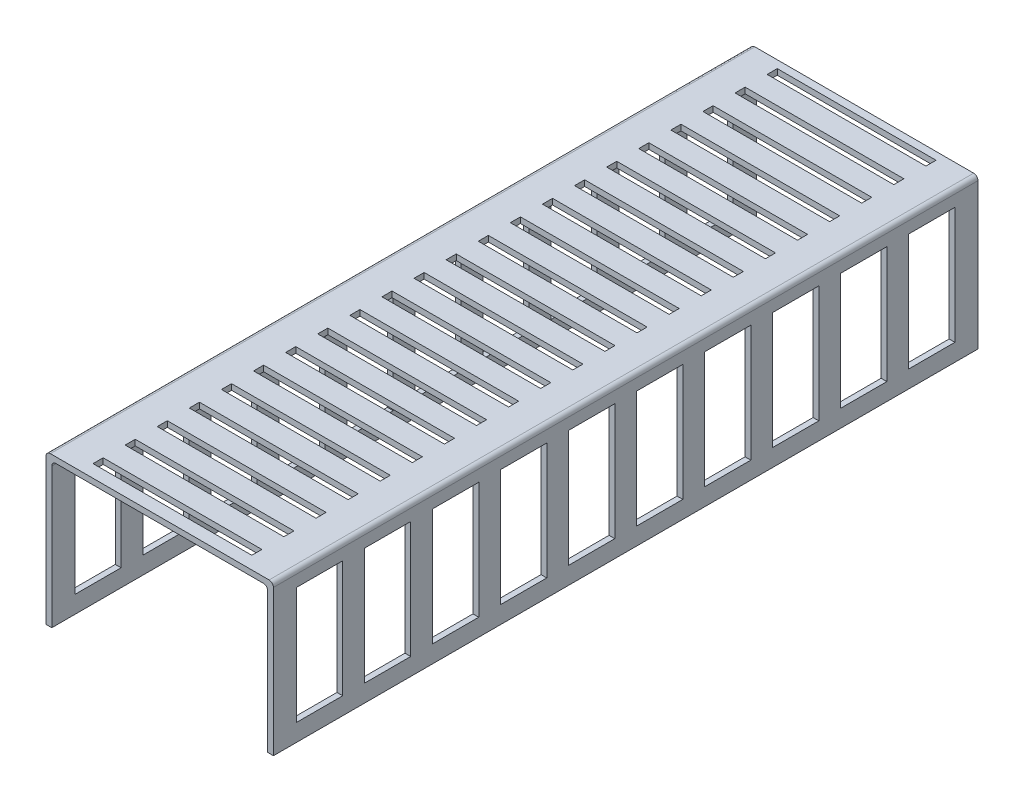
from build123d import *

# Parameters (mm, degrees)
SKETCH2_W           = 78.8
SKETCH2_H           = 244.1
SKETCH2_W_2         = 55
SKETCH2_H_2         = 3.5
BOSS_EXTRUDE1_DEPTH = 2
SKETCH3_W           = 2
SKETCH3_H           = 244.1
BOSS_EXTRUDE2_DEPTH = 50
FILLET1_R           = 1.5
SKETCH4_W           = 16
SKETCH4_H           = 40.5
CUT_EXTRUDE1_DEPTH  = 27275.317552699


with BuildPart() as part:
    # Sketch2 → Boss-Extrude1 (new body)
    with BuildSketch(Plane(origin=(0, 27271.849263039, 0), x_dir=(1, 0, 0), z_dir=(0, 1, 0))):
        with Locations((-7.2, 17)):
            Rectangle(SKETCH2_W, SKETCH2_H)
        with Locations((-7.2, 123.528571429)):
            Rectangle(SKETCH2_W_2, SKETCH2_H_2, mode=Mode.SUBTRACT)
        with Locations((-7.2, 134.65)):
            Rectangle(SKETCH2_W_2, SKETCH2_H_2, mode=Mode.SUBTRACT)
        with Locations((-7.2, 112.407142857)):
            Rectangle(SKETCH2_W_2, SKETCH2_H_2, mode=Mode.SUBTRACT)
        with Locations((-7.2, 101.285714286)):
            Rectangle(SKETCH2_W_2, SKETCH2_H_2, mode=Mode.SUBTRACT)
        with Locations((-7.2, 90.164285714)):
            Rectangle(SKETCH2_W_2, SKETCH2_H_2, mode=Mode.SUBTRACT)
        with Locations((-7.2, 79.042857143)):
            Rectangle(SKETCH2_W_2, SKETCH2_H_2, mode=Mode.SUBTRACT)
        with Locations((-7.2, 67.921428571)):
            Rectangle(SKETCH2_W_2, SKETCH2_H_2, mode=Mode.SUBTRACT)
        with Locations((-7.2, 56.8)):
            Rectangle(SKETCH2_W_2, SKETCH2_H_2, mode=Mode.SUBTRACT)
        with Locations((-7.2, 45.678571429)):
            Rectangle(SKETCH2_W_2, SKETCH2_H_2, mode=Mode.SUBTRACT)
        with Locations((-7.2, 34.557142857)):
            Rectangle(SKETCH2_W_2, SKETCH2_H_2, mode=Mode.SUBTRACT)
        with Locations((-7.2, 23.435714286)):
            Rectangle(SKETCH2_W_2, SKETCH2_H_2, mode=Mode.SUBTRACT)
        with Locations((-7.2, 12.314285714)):
            Rectangle(SKETCH2_W_2, SKETCH2_H_2, mode=Mode.SUBTRACT)
        with Locations((-7.2, 1.192857143)):
            Rectangle(SKETCH2_W_2, SKETCH2_H_2, mode=Mode.SUBTRACT)
        with Locations((-7.2, -9.928571429)):
            Rectangle(SKETCH2_W_2, SKETCH2_H_2, mode=Mode.SUBTRACT)
        with Locations((-7.2, -21.05)):
            Rectangle(SKETCH2_W_2, SKETCH2_H_2, mode=Mode.SUBTRACT)
        with Locations((-7.2, -32.171428571)):
            Rectangle(SKETCH2_W_2, SKETCH2_H_2, mode=Mode.SUBTRACT)
        with Locations((-7.2, -43.292857143)):
            Rectangle(SKETCH2_W_2, SKETCH2_H_2, mode=Mode.SUBTRACT)
        with Locations((-7.2, -54.414285714)):
            Rectangle(SKETCH2_W_2, SKETCH2_H_2, mode=Mode.SUBTRACT)
        with Locations((-7.2, -65.535714286)):
            Rectangle(SKETCH2_W_2, SKETCH2_H_2, mode=Mode.SUBTRACT)
        with Locations((-7.2, -76.657142857)):
            Rectangle(SKETCH2_W_2, SKETCH2_H_2, mode=Mode.SUBTRACT)
        with Locations((-7.2, -87.778571429)):
            Rectangle(SKETCH2_W_2, SKETCH2_H_2, mode=Mode.SUBTRACT)
        with Locations((-7.2, -98.9)):
            Rectangle(SKETCH2_W_2, SKETCH2_H_2, mode=Mode.SUBTRACT)
    extrude(amount=BOSS_EXTRUDE1_DEPTH)

    # Sketch3 → Boss-Extrude2 (add)
    with BuildSketch(Plane.XZ.offset(-27271.849263039)):
        with Locations((-45.6, -17)):
            Rectangle(SKETCH3_W, SKETCH3_H)
        with Locations((31.2, -17)):
            Rectangle(SKETCH3_W, SKETCH3_H)
    extrude(amount=BOSS_EXTRUDE2_DEPTH)

    # Fillet1
    fillet1_edges = [part.edges().sort_by_distance(p)[0] for p in [
        (32.2, 27273.849263039, -17),
        (-44.6, 27271.849263039, -17),
        (30.2, 27271.849263039, -17),
        (-46.6, 27273.849263039, -17),
    ]]
    fillet(fillet1_edges, radius=FILLET1_R)

    # Sketch4 → Cut-Extrude1 (cut, through all)
    with BuildSketch(Plane(origin=(32.2, 0, 0), x_dir=(0, 0, -1), z_dir=(1, 0, 0))):
        with Locations((-89.05, 27248.099263039)):
            Rectangle(SKETCH4_W, SKETCH4_H)
        with Locations((-65.483333333, 27248.099263039)):
            Rectangle(SKETCH4_W, SKETCH4_H)
        with Locations((-41.916666667, 27248.099263039)):
            Rectangle(SKETCH4_W, SKETCH4_H)
        with Locations((-18.35, 27248.099263039)):
            Rectangle(SKETCH4_W, SKETCH4_H)
        with Locations((5.216666667, 27248.099263039)):
            Rectangle(SKETCH4_W, SKETCH4_H)
        with Locations((28.783333333, 27248.099263039)):
            Rectangle(SKETCH4_W, SKETCH4_H)
        with Locations((52.35, 27248.099263039)):
            Rectangle(SKETCH4_W, SKETCH4_H)
        with Locations((75.916666667, 27248.099263039)):
            Rectangle(SKETCH4_W, SKETCH4_H)
        with Locations((99.483333333, 27248.099263039)):
            Rectangle(SKETCH4_W, SKETCH4_H)
        with Locations((123.05, 27248.099263039)):
            Rectangle(SKETCH4_W, SKETCH4_H)
    extrude(amount=-CUT_EXTRUDE1_DEPTH, mode=Mode.SUBTRACT)


solid = part.part
